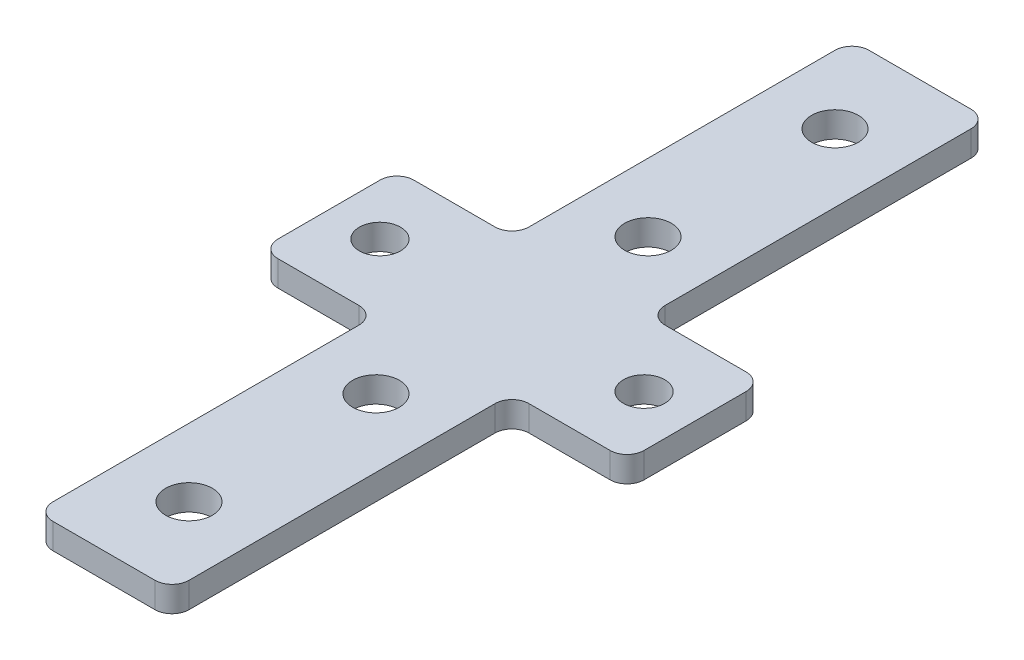
from build123d import *

# Parameters (mm, degrees)
SKETCH_1_R      = 2.75
SKETCH_1_R_2    = 2.423316248
EXTRUDE_1_DEPTH = 3


with BuildPart() as part:
    # 草图1 → 凸台-拉伸1 (new body)
    with BuildSketch(Plane(origin=(0, 0, 0), x_dir=(1, 0, 0), z_dir=(0, 1, 0))):
        with BuildLine():
            Line((-6, 48), (6, 48))
            ThreePointArc((6, 48), (7.414213562, 47.414213562), (8, 46))
            Line((8, 46), (8, 10))
            ThreePointArc((8, 10), (8.585786438, 8.585786438), (10, 8))
            Line((10, 8), (19.538252224, 8))
            ThreePointArc((19.538252224, 8), (20.952465786, 7.414213562), (21.538252224, 6))
            Line((21.538252224, 6), (21.538252224, -6))
            ThreePointArc((21.538252224, -6), (20.952465786, -7.414213562), (19.538252224, -8))
            Line((19.538252224, -8), (10, -8))
            ThreePointArc((10, -8), (8.585786438, -8.585786438), (8, -10))
            Line((8, -10), (8, -46))
            ThreePointArc((8, -46), (7.414213562, -47.414213562), (6, -48))
            Line((6, -48), (-6, -48))
            ThreePointArc((-6, -48), (-7.414213562, -47.414213562), (-8, -46))
            Line((-8, -46), (-8, -10))
            ThreePointArc((-8, -10), (-8.585786438, -8.585786438), (-10, -8))
            Line((-10, -8), (-19.538252224, -8))
            ThreePointArc((-19.538252224, -8), (-20.952465786, -7.414213562), (-21.538252224, -6))
            Line((-21.538252224, -6), (-21.538252224, 6))
            ThreePointArc((-21.538252224, 6), (-20.952465786, 7.414213562), (-19.538252224, 8))
            Line((-19.538252224, 8), (-10, 8))
            ThreePointArc((-10, 8), (-8.585786438, 8.585786438), (-8, 10))
            Line((-8, 10), (-8, 46))
            ThreePointArc((-8, 46), (-7.414213562, 47.414213562), (-6, 48))
        make_face()
        with Locations(Location((0, 38, 0), (0, 0, 270))):
            Circle(SKETCH_1_R, mode=Mode.SUBTRACT)
        with Locations(Location((0, 16, 0), (0, 0, 270))):
            Circle(SKETCH_1_R, mode=Mode.SUBTRACT)
        with Locations(Location((0, -16, 0), (0, 0, 90))):
            Circle(SKETCH_1_R, mode=Mode.SUBTRACT)
        with Locations(Location((0, -38, 0), (0, 0, 90))):
            Circle(SKETCH_1_R, mode=Mode.SUBTRACT)
        with Locations(Location((-15.538252224, 0, 0), (0, 0, 270))):
            Circle(SKETCH_1_R_2, mode=Mode.SUBTRACT)
        with Locations(Location((15.538252224, 0, 0), (0, 0, 90))):
            Circle(SKETCH_1_R_2, mode=Mode.SUBTRACT)
    extrude(amount=EXTRUDE_1_DEPTH)


solid = part.part
